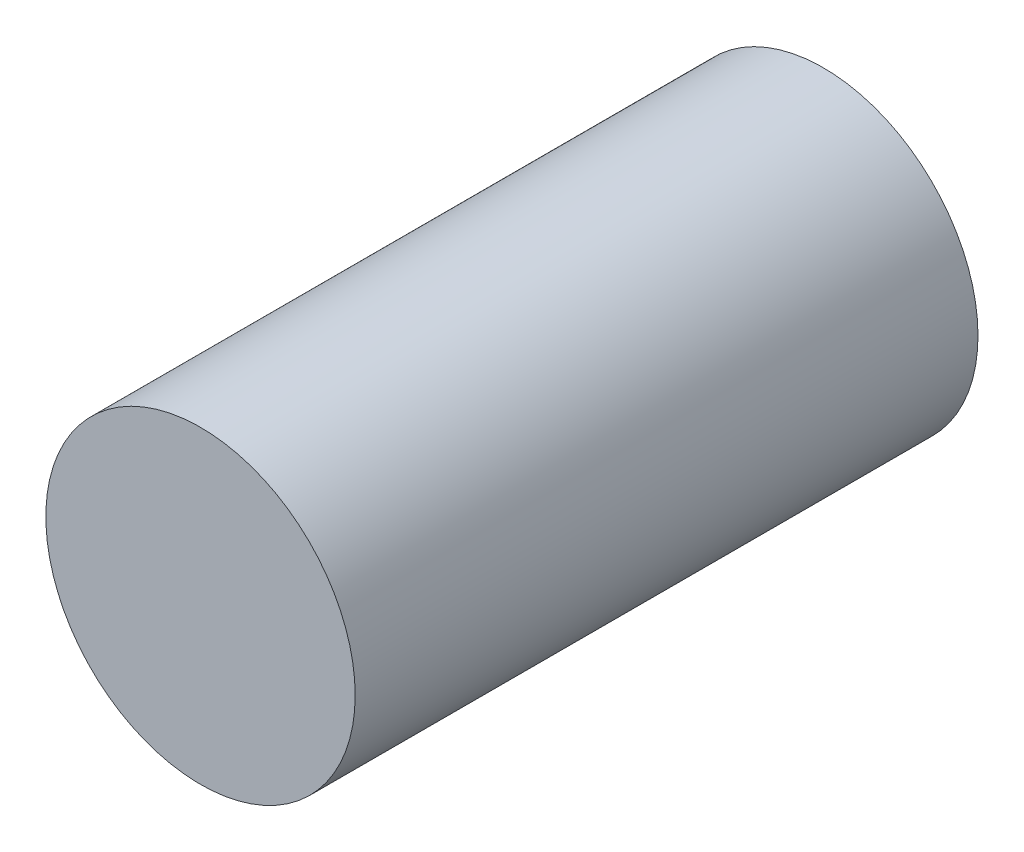
from build123d import *

# Parameters (mm, degrees)
SKETCH3_R           = 7.45
BOSS_EXTRUDE1_DEPTH = 30


with BuildPart() as part:
    # Sketch3 → Boss-Extrude1 (new body)
    with BuildSketch(Plane.XY):
        with Locations((-11.107827279, 4.135464654)):
            Circle(SKETCH3_R)
    extrude(amount=BOSS_EXTRUDE1_DEPTH)


solid = part.part
